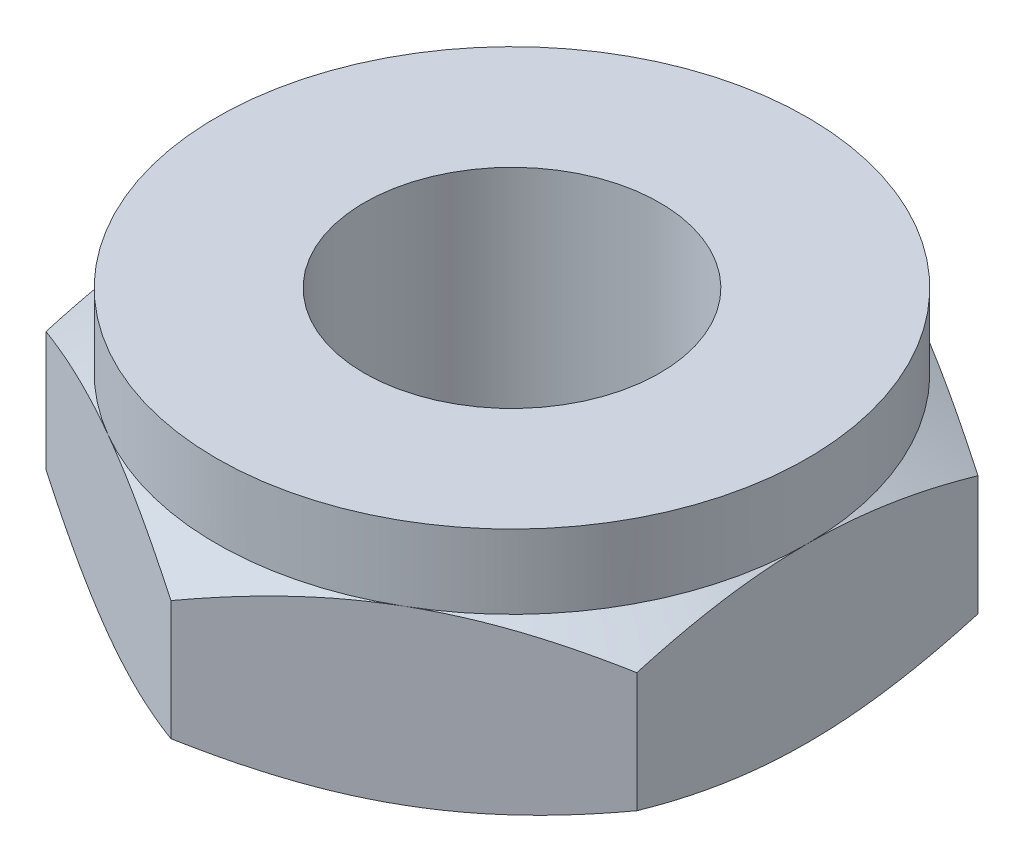
from build123d import *

# Parameters (mm, degrees)
BODYS_R             = 3
BODY_DEPTH          = 1.75
CHAMFERS_OUTSIDE_W  = 55.182
CHAMFERS_OUTSIDE_H  = 57.038
CHAMFERS_OUTSIDE_R  = 6
CHAMFER_2_DEPTH     = 10.810708435
CHAMFER_2_DRAFT     = -60
CM_COPY_1_SKETCH_W  = 55.182
CM_COPY_1_SKETCH_H  = 57.038
CM_COPY_1_SKETCH_R  = 6
CM_COPY_1_DEPTH     = 10.810708435
CM_COPY_1_DRAFT     = -60
FASTENINGBASES_R    = 6
FASTENINGBASES_R_2  = 3
FASTENINGBASE_DEPTH = 1.5


with BuildPart() as part:
    # BodyS → Body (new, symmetric)
    with BuildSketch(Plane(origin=(0, 0, 0), x_dir=(1, 0, 0), z_dir=(0, 1, 0))):
        Polygon((-6, 3.464101615), (-6, -3.464101615), (0, -6.92820323), (6, -3.464101615), (6, 3.464101615), (0, 6.92820323), align=None)
        with Locations(Location((0, 0, 0), (0, 0, 270))):
            Circle(BODYS_R, mode=Mode.SUBTRACT)
    extrude(amount=BODY_DEPTH, both=True)


with BuildPart() as chamfer_2_tool:
    # ChamferS outside → Chamfer 2 (with draft: the straight prism first)
    with BuildSketch(Plane(origin=(0, 1.75, 0), x_dir=(1, 0, 0), z_dir=(0, 1, 0))):
        Rectangle(CHAMFERS_OUTSIDE_W, CHAMFERS_OUTSIDE_H)
        Circle(CHAMFERS_OUTSIDE_R, mode=Mode.SUBTRACT)
    extrude(amount=-CHAMFER_2_DEPTH)
    # Chamfer 2: the draft: its side faces are tilted about the plane it starts from
    chamfer_2_sides = [chamfer_2_tool.faces().sort_by_distance(p)[0] for p in [
        (0, -3.655354218, 28.519),
        (27.591, -3.655354218, 0),
        (0, -3.655354218, -28.519),
        (-27.591, -3.655354218, 0),
        (-6, -3.655354218, 0),
    ]]
    draft(chamfer_2_sides, Plane(origin=(0, 1.75, 0), x_dir=(1, 0, 0), z_dir=(0, 1, 0)), CHAMFER_2_DRAFT)


with BuildPart() as part_1:
    add(part.part)

    # Chamfer 2: cut by chamfer_2_tool
    add(chamfer_2_tool.part, mode=Mode.SUBTRACT)


with BuildPart() as cm_copy_1_tool:
    # CM copy 1 sketch → CM copy 1 (with draft: the straight prism first)
    with BuildSketch(Plane.XZ.offset(1.75)):
        Rectangle(CM_COPY_1_SKETCH_W, CM_COPY_1_SKETCH_H)
        Circle(CM_COPY_1_SKETCH_R, mode=Mode.SUBTRACT)
    extrude(amount=-CM_COPY_1_DEPTH)
    # CM copy 1: the draft: its side faces are tilted about the plane it starts from
    cm_copy_1_sides = [cm_copy_1_tool.faces().sort_by_distance(p)[0] for p in [
        (0, 3.655354218, 28.519),
        (27.591, 3.655354218, 0),
        (0, 3.655354218, -28.519),
        (-27.591, 3.655354218, 0),
        (-6, 3.655354218, 0),
    ]]
    draft(cm_copy_1_sides, Plane.XZ.offset(1.75), CM_COPY_1_DRAFT)


with BuildPart() as part_2:
    add(part_1.part)

    # CM copy 1: cut by cm_copy_1_tool
    add(cm_copy_1_tool.part, mode=Mode.SUBTRACT)

    # FasteningBaseS → FasteningBase (add)
    with BuildSketch(Plane(origin=(0, 1.75, 0), x_dir=(1, 0, 0), z_dir=(0, 1, 0))):
        with Locations(Location((0, 0, 0), (0, 0, 60))):
            Circle(FASTENINGBASES_R)
        with Locations(Location((0, 0, 0), (0, 0, 270))):
            Circle(FASTENINGBASES_R_2, mode=Mode.SUBTRACT)
    extrude(amount=FASTENINGBASE_DEPTH)


solid = part_2.part
